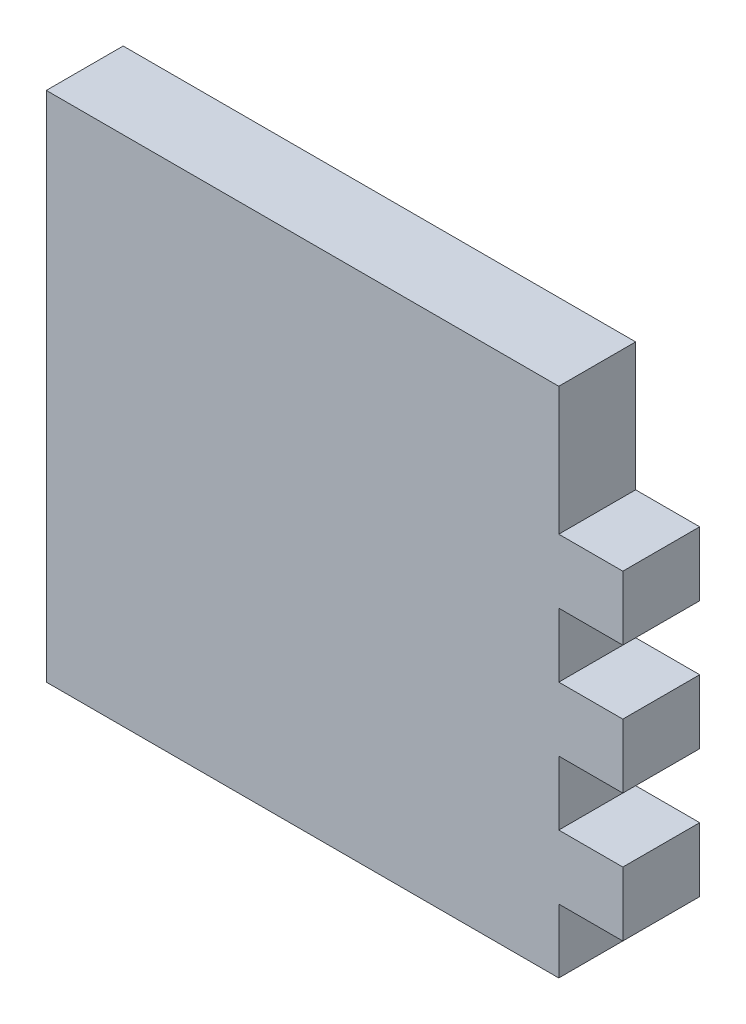
from build123d import *

# Parameters (mm, degrees)
BOSS_EXTRUDE1_DEPTH = 6
SKETCH1_4_W         = 5
SKETCH1_4_H         = 5
BOSS_EXTRUDE2_DEPTH = 6


with BuildPart() as part:
    # Sketch1 → Boss-Extrude1 (new body)
    with BuildSketch(Plane.XY):
        Polygon((27.313432836, 14.402985075), (-12.686567164, 14.402985075), (-12.686567164, -25.597014925), (27.313432836, -25.597014925), (27.313432836, -20.597014925), (27.313432836, -15.597014925), (27.313432836, -10.597014925), (27.313432836, -5.597014925), (27.313432836, -0.597014925), (27.313432836, 4.402985075), align=None)
    extrude(amount=BOSS_EXTRUDE1_DEPTH)

    # Sketch1<4> → Boss-Extrude2 (add)
    with BuildSketch(Plane.XY):
        with Locations((29.813432836, 1.902985075)):
            Rectangle(SKETCH1_4_W, SKETCH1_4_H)
        with Locations((29.813432836, -18.097014925)):
            Rectangle(SKETCH1_4_W, SKETCH1_4_H)
        with Locations((29.813432836, -8.097014925)):
            Rectangle(SKETCH1_4_W, SKETCH1_4_H)
    extrude(amount=BOSS_EXTRUDE2_DEPTH)


solid = part.part
